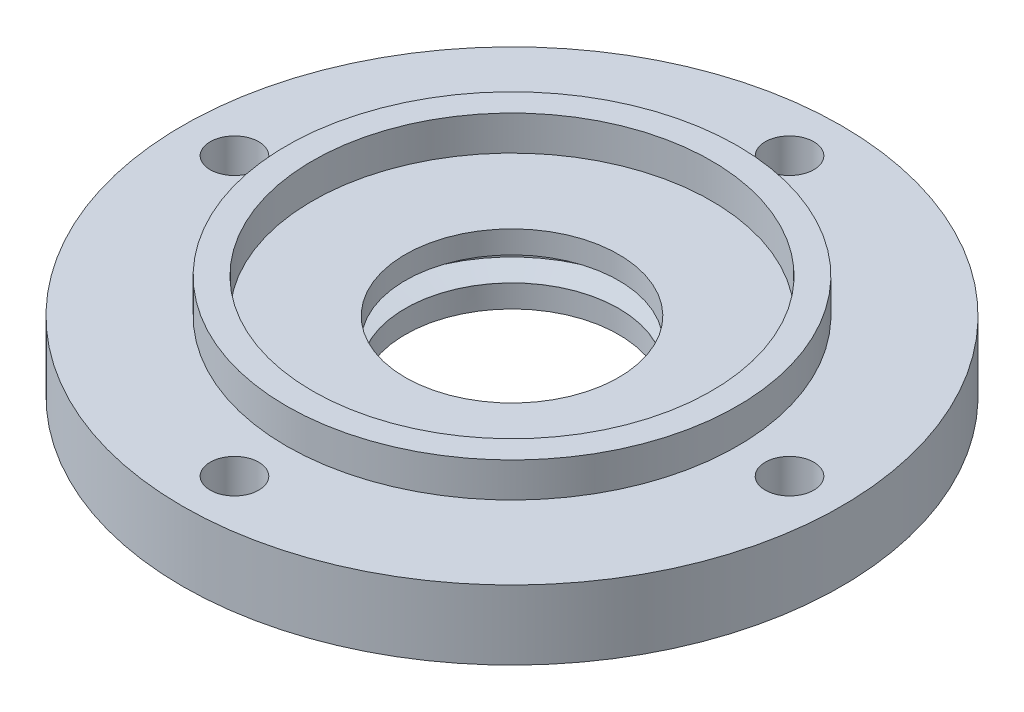
from build123d import *

# Parameters (mm, degrees)
SKETCH1_R           = 95
BOSS_EXTRUDE1_DEPTH = 10
SKETCH2_R           = 65
BOSS_EXTRUDE2_DEPTH = 10
SKETCH3_R           = 57.5
CUT_EXTRUDE1_DEPTH  = 10
SKETCH4_R           = 7
CUT_EXTRUDE2_DEPTH  = 136.830777072
SKETCH5_R           = 30.75
CUT_EXTRUDE3_DEPTH  = 136.830777072


with BuildPart() as part:
    # Sketch1 → Boss-Extrude1 (new, symmetric)
    with BuildSketch(Plane(origin=(0, 0, 0), x_dir=(1, 0, 0), z_dir=(0, 1, 0))):
        with Locations(Location((0, 0, 0), (0, 0, 270))):
            Circle(SKETCH1_R)
    extrude(amount=BOSS_EXTRUDE1_DEPTH, both=True)

    # Sketch2 → Boss-Extrude2 (add)
    with BuildSketch(Plane(origin=(0, 10, 0), x_dir=(1, 0, 0), z_dir=(0, 1, 0))):
        with Locations(Location((0, 0, 0), (0, 0, 270))):
            Circle(SKETCH2_R)
    extrude(amount=BOSS_EXTRUDE2_DEPTH)

    # Sketch3 → Cut-Extrude1 (cut)
    with BuildSketch(Plane(origin=(0, 20, 0), x_dir=(1, 0, 0), z_dir=(0, 1, 0))):
        with Locations(Location((0, 0, 0), (0, 0, 270))):
            Circle(SKETCH3_R)
    extrude(amount=-CUT_EXTRUDE1_DEPTH, mode=Mode.SUBTRACT)

    # Sketch4 → Cut-Extrude2 (cut, through all)
    with BuildSketch(Plane(origin=(0, 10, 0), x_dir=(1, 0, 0), z_dir=(0, 1, 0))):
        with Locations(Location((0, 80, 0), (0, 0, 270))):
            Circle(SKETCH4_R)
        with Locations(Location((80, 0, 0), (0, 0, 270))):
            Circle(SKETCH4_R)
        with Locations(Location((0, -80, 0), (0, 0, 270))):
            Circle(SKETCH4_R)
        with Locations(Location((-80, 0, 0), (0, 0, 270))):
            Circle(SKETCH4_R)
    extrude(amount=-CUT_EXTRUDE2_DEPTH, mode=Mode.SUBTRACT)

    # Sketch5 → Cut-Extrude3 (cut, through all)
    with BuildSketch(Plane(origin=(0, 10, 0), x_dir=(1, 0, 0), z_dir=(0, 1, 0))):
        with Locations(Location((0, 0, 0), (0, 0, 270))):
            Circle(SKETCH5_R)
    extrude(amount=-CUT_EXTRUDE3_DEPTH, mode=Mode.SUBTRACT)

    # Sketch6 → Cut-Revolve3 (revolve, cut)
    with BuildSketch(Plane(origin=(0, 0, 0), x_dir=(0, 0, -1), z_dir=(1, 0, 0))):
        Polygon((0, 3.5), (-30.814786926, 3.5), (-38.5, 2.5), (-38.5, -2.5), (-30.814786926, -3.5), (0, -3.5), align=None)
    revolve(axis=Axis((0, 3.5, 0), (0, -1, 0)), mode=Mode.SUBTRACT)


solid = part.part
